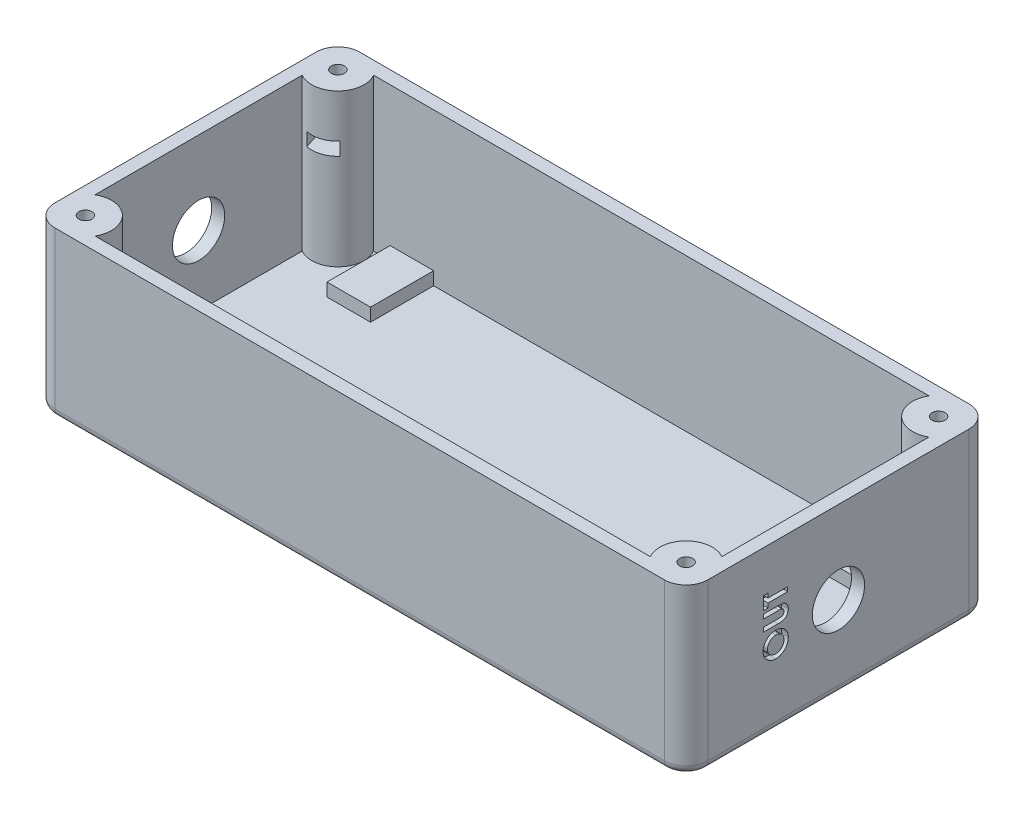
from build123d import *

# Parameters (mm, degrees)
SKETCH_1_W          = 150
SKETCH_1_H          = 70
EXTRUDE_1_DEPTH     = 3
SKETCH_2_W          = 150
SKETCH_2_H          = 70
SKETCH_2_W_2        = 144
SKETCH_2_H_2        = 64
EXTRUDE_2_DEPTH     = 35
SKETCH_3_W          = 10
SKETCH_3_H          = 16.721114434
SKETCH_3_W_2        = 8
SKETCH_3_H_2        = 14.721114434
SKETCH_3_H_3        = 16.439593866
SKETCH_3_H_4        = 20.439593866
EXTRUDE_3_DEPTH     = 3
SKETCH_4_R          = 6.003839286
SKETCH_4_R_2        = 6.002730944
SKETCH_4_R_3        = 5.998096078
SKETCH_4_R_4        = 6.003357904
EXTRUDE_4_DEPTH     = 35
CUT_EXTRUDE_1_DEPTH = 3
SKETCH_6_R          = 1.5
CUT_EXTRUDE_2_DEPTH = 19
FILLET_1_R          = 5
FILLET_2_R          = 2
SKETCH_7_R          = 6
CUT_EXTRUDE_3_DEPTH = 19
CUT_EXTRUDE_START   = -19
SKETCH_8_R          = 6
CUT_EXTRUDE_4_DEPTH = 19
CUT_EXTRUDE_5_DEPTH = 1.5
CUT_EXTRUDE_6_DEPTH = 1.5


with BuildPart() as part:
    # Эскиз1 → Бобышка-Вытянуть1 (new body)
    with BuildSketch(Plane(origin=(0, 0, 0), x_dir=(1, 0, 0), z_dir=(0, 1, 0))):
        Rectangle(SKETCH_1_W, SKETCH_1_H)
    extrude(amount=EXTRUDE_1_DEPTH)

    # Эскиз2 → Бобышка-Вытянуть2 (add)
    with BuildSketch(Plane(origin=(0, 3, 0), x_dir=(1, 0, 0), z_dir=(0, 1, 0))):
        Rectangle(SKETCH_2_W, SKETCH_2_H)
        Rectangle(SKETCH_2_W_2, SKETCH_2_H_2, mode=Mode.SUBTRACT)
    extrude(amount=EXTRUDE_2_DEPTH)

    # Эскиз3 → Бобышка-Вытянуть3 (add)
    with BuildSketch(Plane(origin=(0, 3, 0), x_dir=(1, 0, 0), z_dir=(0, 1, 0))):
        with Locations((-55, 25.860557217)):
            Rectangle(SKETCH_3_W, SKETCH_3_H)
        with Locations((56, 26.860557217)):
            Rectangle(SKETCH_3_W_2, SKETCH_3_H_2)
        with Locations((-55, -25.719796933)):
            Rectangle(SKETCH_3_W, SKETCH_3_H_3)
        with Locations((56, -23.719796933)):
            Rectangle(SKETCH_3_W_2, SKETCH_3_H_4)
    extrude(amount=EXTRUDE_3_DEPTH)

    # Эскиз4 → Бобышка-Вытянуть4 (add)
    with BuildSketch(Plane(origin=(0, 3, 0), x_dir=(1, 0, 0), z_dir=(0, 1, 0))):
        with Locations((-68.996160714, 28.996160714)):
            Circle(SKETCH_4_R)
        with Locations((-68.997269056, -28.997269056)):
            Circle(SKETCH_4_R_2)
        with Locations((69.001903922, 29.001903922)):
            Circle(SKETCH_4_R_3)
        with Locations((68.996642096, -28.996642096)):
            Circle(SKETCH_4_R_4)
    extrude(amount=EXTRUDE_4_DEPTH)

    # Эскиз5 → Вырез-Вытянуть1 (cut)
    with BuildSketch(Plane(origin=(0, 28, 0), x_dir=(1, 0, 0), z_dir=(0, 1, 0))):
        Polygon((-71.315779532, 26.423347363), (-69.499270993, 20.820248272), (-69.121054775, 20.105300037), (-63.546010091, 21.912713418), (-65.608229584, 28.273718567), (-66.676541897, 31.568974066), (-70.064473027, 32.291416213), (-72.384091845, 29.718602861), align=None)
        Polygon((-69.466273228, -25.565063484), (-72.204148358, -27.687335797), (-71.735144186, -31.119541369), (-68.528264884, -32.429474628), (-65.790389754, -30.307202314), (-61.26592419, -26.800048941), (-64.941807664, -22.057910111), align=None)
        Polygon((70.170175126, 25.740747318), (72.410283988, 28.383078161), (71.242012784, 31.644234765), (67.833632717, 32.263060525), (65.593523855, 29.620729682), (61.703168869, 25.031843337), (61.278998761, 24.8214936), (65.998686325, 20.820248272), align=None)
        Polygon((65.808720099, -30.352058393), (68.576506043, -32.43517168), (71.764428041, -31.079755383), (72.184564094, -27.641225799), (69.416778149, -25.558112513), (64.423123183, -21.799747807), (63.845896179, -21.438801652), (60.273148209, -26.18583182), align=None)
    extrude(amount=-CUT_EXTRUDE_1_DEPTH, mode=Mode.SUBTRACT)

    # Эскиз6 → Вырез-Вытянуть2 (cut)
    with BuildSketch(Plane(origin=(0, 38, 0), x_dir=(1, 0, 0), z_dir=(0, 1, 0))):
        with Locations(Location((-68.996160714, 28.996160714, 0), (0, 0, 270))):
            Circle(SKETCH_6_R)
        with Locations(Location((69.001903922, 29.001903922, 0), (0, 0, 270))):
            Circle(SKETCH_6_R)
        with Locations(Location((68.996642096, -28.996642096, 0), (0, 0, 270))):
            Circle(SKETCH_6_R)
        with Locations(Location((-68.997269056, -28.997269056, 0), (0, 0, 270))):
            Circle(SKETCH_6_R)
    extrude(amount=-CUT_EXTRUDE_2_DEPTH, mode=Mode.SUBTRACT)

    # Скругление1
    fillet_1_edges = [part.edges().sort_by_distance(p)[0] for p in [
        (75, 20.5, -35),
        (75, 20.5, 35),
        (-75, 19, 35),
        (-75, 19, -35),
    ]]
    fillet(fillet_1_edges, radius=FILLET_1_R)

    # Скругление2
    fillet_2_edges = [part.edges().sort_by_distance(p)[0] for p in [
        (0, 0, -35),
        (75, 0, 0),
        (0, 0, 35),
        (-75, 0, 0),
        (-73.535533906, 0, 33.535533906),
        (-73.535533906, 0, -33.535533906),
        (73.535533906, 0, 33.535533906),
        (73.535533906, 0, -33.535533906),
    ]]
    fillet(fillet_2_edges, radius=FILLET_2_R)

    # Эскиз7 → Вырез-Вытянуть3 (cut)
    with BuildSketch(Plane.ZY.offset(75)):
        with Locations((0, 19)):
            Circle(SKETCH_7_R)
    extrude(amount=-CUT_EXTRUDE_3_DEPTH, mode=Mode.SUBTRACT)

    # Эскиз8 → Вырез-Вытянуть4 (cut)
    with BuildSketch(Plane(origin=(75, 0, 0), x_dir=(0, 0, -1), z_dir=(1, 0, 0)).offset(CUT_EXTRUDE_START)):
        with Locations(Location((0, 19, 0), (0, 0, 180))):
            Circle(SKETCH_8_R)
    extrude(amount=CUT_EXTRUDE_4_DEPTH, mode=Mode.SUBTRACT)

    # Эскиз9 → Вырез-Вытянуть5 (cut)
    # profile 1 of 4: a face of its own
    with BuildSketch(Plane.ZY.offset(75)):
        Polygon((-15.787488815, 25.603367713), (-15.787488815, 26.657754732), (-11.880637854, 28.071316431), (-15.787488815, 29.488183418), (-15.787488815, 30.539265149), (-10.287488815, 28.545074443), (-10.287488815, 27.594253129), align=None)
    # profile 2 of 4: a face of its own
    with BuildSketch(Plane.ZY.offset(75)):
        with BuildLine():
            add(Edge.make_bspline(
                [(-15.928514456, 21.074020758), (-15.927805241, 21.121804417), (-15.926410736, 21.215759858), (-15.911301912, 21.354137251), (-15.88848745, 21.48743788), (-15.856631116, 21.616160204), (-15.81460728, 21.739461341), (-15.763885282, 21.857772634), (-15.703986372, 21.970987348), (-15.634635156, 22.079225399), (-15.554760816, 22.181520013), (-15.466694512, 22.279525146), (-15.367032767, 22.369311211), (-15.258354786, 22.453591284), (-15.140010797, 22.531789764), (-15.012345477, 22.604411662), (-14.874570904, 22.670733053), (-14.7264846, 22.731544955), (-14.565853649, 22.785920365), (-14.390839346, 22.831721483), (-14.201400614, 22.871003373), (-13.997066239, 22.904160128), (-13.777564514, 22.929221257), (-13.543041295, 22.946112968), (-13.293948699, 22.957704858), (-13.123073225, 22.958650907), (-13.035285289, 22.959136943)],
                knots=[0, 0, 0, 0, 0.879187688, 1.728717895, 2.558878706, 3.367146394, 4.166631857, 4.95393622, 5.734098362, 6.521634849, 7.316678452, 8.120609651, 8.943639266, 9.781961388, 10.650008082, 11.55217958, 12.483362701, 13.462505087, 14.497127373, 15.602264045, 16.790140859, 18.057036744, 19.411188506, 20.855078804, 22.384284574, 24, 24, 24, 24], degree=3))
            add(Edge.make_bspline(
                [(-13.035285289, 22.959136943), (-12.946399052, 22.958611583), (-12.773694688, 22.957590817), (-12.522323434, 22.946595773), (-12.286098584, 22.927655651), (-12.065038029, 22.903263513), (-11.859280703, 22.869786697), (-11.668566267, 22.830866357), (-11.492858717, 22.783925247), (-11.332143689, 22.72807235), (-11.183655, 22.667166838), (-11.045602574, 22.60171935), (-10.919010662, 22.528891672), (-10.799869963, 22.455321113), (-10.693388995, 22.372798497), (-10.59537812, 22.287434444), (-10.509588274, 22.194890626), (-10.43153036, 22.099171955), (-10.364075847, 21.996743622), (-10.305080389, 21.888669267), (-10.257228284, 21.773020153), (-10.215609016, 21.651904894), (-10.185730887, 21.523258912), (-10.16202357, 21.389126413), (-10.148921453, 21.247993056), (-10.147296049, 21.151903783), (-10.146463174, 21.102666591)],
                knots=[0, 0, 0, 0, 1.643824397, 3.193921316, 4.652018541, 6.026147715, 7.305813021, 8.506024873, 9.624771103, 10.66654028, 11.650369642, 12.592128821, 13.489360096, 14.35046321, 15.179132238, 15.977837183, 16.751455772, 17.509897991, 18.259653136, 19.016390304, 19.783391144, 20.571659993, 21.382176161, 22.223003704, 23.089447706, 24, 24, 24, 24], degree=3))
            add(Edge.make_bspline(
                [(-10.146463174, 21.102666591), (-10.147312282, 21.053430817), (-10.148975673, 20.956978659), (-10.161924286, 20.815462416), (-10.185833555, 20.680623571), (-10.215814591, 20.550943702), (-10.257222624, 20.427420235), (-10.306170987, 20.308956633), (-10.366367047, 20.197895415), (-10.433688597, 20.091948159), (-10.511272709, 19.992788146), (-10.597900348, 19.898945455), (-10.692357216, 19.809107408), (-10.797925509, 19.726474648), (-10.912676828, 19.649569235), (-11.036595275, 19.577575007), (-11.170085911, 19.511954321), (-11.313112652, 19.450512607), (-11.469107402, 19.39615374), (-11.639536977, 19.349279724), (-11.825677707, 19.309577057), (-12.027343317, 19.278372685), (-12.244560635, 19.253209137), (-12.477155377, 19.234548341), (-12.725213438, 19.22348628), (-12.895717046, 19.222477062), (-12.983502437, 19.221957456)],
                knots=[0, 0, 0, 0, 0.917318694, 1.797013832, 2.644089644, 3.467281984, 4.274391433, 5.068665368, 5.852346333, 6.624865025, 7.405043053, 8.194438745, 9.002823433, 9.831034161, 10.688848002, 11.574933485, 12.499091769, 13.45866927, 14.473616003, 15.574277631, 16.749933499, 18.017757418, 19.374908438, 20.82337846, 22.364486432, 24, 24, 24, 24], degree=3))
            add(Edge.make_bspline(
                [(-12.983502437, 19.221957456), (-13.105473211, 19.222899304), (-13.340817391, 19.224716612), (-13.680821304, 19.247746873), (-13.995096025, 19.281549454), (-14.283115848, 19.331197439), (-14.545947517, 19.392586486), (-14.781859632, 19.471198356), (-14.994116568, 19.560692253), (-15.119858855, 19.63695255), (-15.180417501, 19.673680213)],
                knots=[0, 0, 0, 0, 1.288568992, 2.486310467, 3.599230591, 4.627010532, 5.572937695, 6.447898582, 7.252493626, 8, 8, 8, 8], degree=3))
            add(Edge.make_bspline(
                [(-15.180417501, 19.673680213), (-15.239910296, 19.71638539), (-15.356230434, 19.799882427), (-15.508937031, 19.945879329), (-15.639539191, 20.102733993), (-15.74508127, 20.273668122), (-15.828311761, 20.455978323), (-15.88709652, 20.651229821), (-15.92134726, 20.858701586), (-15.926089715, 21.001175907), (-15.928514456, 21.074020758)],
                knots=[0, 0, 0, 0, 1.058512271, 2.069600068, 3.047294572, 4.004278952, 4.967380941, 5.939006123, 6.946246673, 8, 8, 8, 8], degree=3))
        make_face()
        with BuildLine():
            add(Edge.make_bspline(
                [(-14.941334969, 21.09825954), (-14.939281259, 21.055067212), (-14.935254897, 20.970387322), (-14.901270964, 20.847436689), (-14.848383698, 20.731999541), (-14.786337854, 20.643215562), (-14.725603947, 20.577514602), (-14.670699099, 20.531394797), (-14.609383257, 20.486938244), (-14.538922468, 20.447718842), (-14.461643082, 20.410308506), (-14.377322482, 20.374878403), (-14.284587327, 20.344413193), (-14.184061923, 20.315357076), (-14.073312367, 20.290227233), (-13.951268717, 20.268238767), (-13.817514294, 20.249506737), (-13.67148846, 20.23599686), (-13.513956399, 20.223592362), (-13.344238793, 20.214660708), (-13.162371299, 20.21093485), (-13.037122289, 20.209748952), (-12.972484809, 20.209136943)],
                knots=[0, 0, 0, 0, 1.076486532, 2.110485037, 3.16053299, 4.233735637, 4.798028448, 5.389657808, 6.0205397, 6.6857231, 7.399126456, 8.163539924, 8.966557062, 9.834164971, 10.774831688, 11.799768806, 12.928987201, 14.14492726, 15.459726247, 16.873396567, 18.386448164, 20, 20, 20, 20], degree=3))
            add(Edge.make_bspline(
                [(-12.972484809, 20.209136943), (-12.888744241, 20.210146739), (-12.728165495, 20.212083096), (-12.497240307, 20.222157328), (-12.286743427, 20.242589178), (-12.095860349, 20.267406071), (-11.925703925, 20.303245243), (-11.774762633, 20.343803208), (-11.644390574, 20.394136126), (-11.533023098, 20.452277299), (-11.438283998, 20.516677424), (-11.357755106, 20.586585172), (-11.288020942, 20.659622076), (-11.231376726, 20.738067452), (-11.187967214, 20.821734254), (-11.156743287, 20.909923992), (-11.137629821, 21.002692716), (-11.134979397, 21.066219781), (-11.133642661, 21.09825954)],
                knots=[0, 0, 0, 0, 1.771738815, 3.39744054, 4.888007323, 6.245018868, 7.467093912, 8.564230264, 9.548241846, 10.417081984, 11.216594933, 11.965786359, 12.669352538, 13.348558586, 14.005353126, 14.656563323, 15.322440191, 16, 16, 16, 16], degree=3))
            add(Edge.make_bspline(
                [(-11.133642661, 21.09825954), (-11.134557355, 21.129199795), (-11.136348213, 21.189776968), (-11.154731123, 21.278112052), (-11.184617743, 21.361647985), (-11.226894465, 21.440132544), (-11.280655785, 21.51384646), (-11.346137954, 21.582429462), (-11.423993675, 21.645364313), (-11.481774136, 21.682030443), (-11.511547309, 21.700923802)],
                knots=[0, 0, 0, 0, 0.992283464, 1.942767638, 2.88273346, 3.832339453, 4.79467288, 5.803907806, 6.868395428, 8, 8, 8, 8], degree=3))
            add(Edge.make_bspline(
                [(-11.511547309, 21.700923802), (-11.552231398, 21.723167552), (-11.637542634, 21.76981089), (-11.781502164, 21.823786641), (-11.94386472, 21.86922042), (-12.125135591, 21.90832461), (-12.326029731, 21.93506949), (-12.545273253, 21.958102148), (-12.783970178, 21.969211371), (-12.949340268, 21.971018347), (-13.035285289, 21.971957456)],
                knots=[0, 0, 0, 0, 0.710965849, 1.490837728, 2.352621235, 3.297892224, 4.334225155, 5.461620853, 6.680770821, 8, 8, 8, 8], degree=3))
            add(Edge.make_bspline(
                [(-13.035285289, 21.971957456), (-13.121976355, 21.971594699), (-13.288841856, 21.970896452), (-13.528396914, 21.958085653), (-13.747190701, 21.940245636), (-13.94473474, 21.914150841), (-14.121508582, 21.880575144), (-14.277500671, 21.839192971), (-14.413018438, 21.790406468), (-14.527926751, 21.732551489), (-14.625583055, 21.668473505), (-14.709364589, 21.600452769), (-14.780895149, 21.528201661), (-14.840443916, 21.45184101), (-14.885943641, 21.36960342), (-14.918070211, 21.283059738), (-14.937505708, 21.192032541), (-14.94004132, 21.129939106), (-14.941334969, 21.09825954)],
                knots=[0, 0, 0, 0, 1.793836731, 3.452829483, 4.963243077, 6.335886805, 7.574563692, 8.684454726, 9.672768357, 10.54971625, 11.340229787, 12.085688095, 12.778991901, 13.440269426, 14.083255152, 14.715733572, 15.344777694, 16, 16, 16, 16], degree=3))
        make_face(mode=Mode.SUBTRACT)
    # profile 3 of 4: a face of its own
    with BuildSketch(Plane.ZY.offset(75)):
        with BuildLine():
            Line((-13.954155482, 15.978367713), (-13.954155482, 14.991188226))
            add(Edge.make_bspline(
                [(-13.954155482, 14.991188226), (-14.028831169, 14.995450028), (-14.174742978, 15.003777335), (-14.386671447, 15.03693759), (-14.586969544, 15.081257019), (-14.775035095, 15.140912066), (-14.950947109, 15.21439064), (-15.11412289, 15.303521536), (-15.265731668, 15.405643625), (-15.403114527, 15.522815368), (-15.526625895, 15.650281332), (-15.634602775, 15.787714738), (-15.724993545, 15.934725187), (-15.799141506, 16.090329655), (-15.858469425, 16.253916944), (-15.898114057, 16.427139873), (-15.9249676, 16.608469976), (-15.927317012, 16.732606216), (-15.928514456, 16.795875726)],
                knots=[0, 0, 0, 0, 1.198928049, 2.342633425, 3.435730849, 4.486331048, 5.502589352, 6.488331875, 7.46361919, 8.428949135, 9.378681775, 10.305958057, 11.226249248, 12.140413166, 13.066341608, 14.010670971, 14.986082777, 16, 16, 16, 16], degree=3))
            add(Edge.make_bspline(
                [(-15.928514456, 16.795875726), (-15.926254085, 16.873573027), (-15.921839371, 17.025323015), (-15.879203681, 17.245094854), (-15.813914106, 17.45144805), (-15.719057362, 17.642187592), (-15.59944224, 17.816981855), (-15.456543141, 17.974859041), (-15.288624085, 18.112740042), (-15.100520713, 18.229549545), (-14.900947905, 18.32614485), (-14.694958239, 18.394484462), (-14.487868215, 18.439166673), (-14.348440781, 18.443943421), (-14.279175514, 18.446316431)],
                knots=[0, 0, 0, 0, 1.075374184, 2.100304875, 3.089917907, 4.066149699, 5.039978333, 6.01615708, 7.006437042, 8.039858286, 9.077679641, 10.07047942, 11.041445745, 12, 12, 12, 12], degree=3))
            add(Edge.make_bspline(
                [(-14.279175514, 18.446316431), (-14.237278176, 18.445393691), (-14.152949186, 18.443536443), (-14.025338724, 18.430622758), (-13.895352554, 18.411249671), (-13.763102107, 18.382039801), (-13.628550381, 18.345612614), (-13.491294438, 18.3014215), (-13.352113534, 18.248439837), (-13.209437014, 18.187557903), (-13.062818487, 18.114905101), (-12.909990691, 18.030395323), (-12.751116323, 17.931203214), (-12.584637046, 17.820557778), (-12.41309481, 17.694106195), (-12.234584774, 17.555198047), (-12.049388217, 17.403134107), (-11.925538631, 17.295292433), (-11.861907886, 17.239886142)],
                knots=[0, 0, 0, 0, 0.728277616, 1.465842947, 2.227925269, 3.011838508, 3.818735656, 4.650581052, 5.517389122, 6.406849312, 7.346234817, 8.360743166, 9.441530624, 10.601362564, 11.834937575, 13.145232671, 14.533293658, 16, 16, 16, 16], degree=3))
            Line((-11.861907886, 17.239886142), (-11.204155482, 16.665867713))
            Line((-11.204155482, 16.665867713), (-11.204155482, 18.516829251))
            Line((-11.204155482, 18.516829251), (-10.287488815, 18.516829251))
            Line((-10.287488815, 18.516829251), (-10.287488815, 14.850162585))
            Line((-10.287488815, 14.850162585), (-10.787689136, 14.850162585))
            Line((-10.787689136, 14.850162585), (-12.520762052, 16.478568033))
            add(Edge.make_bspline(
                [(-12.520762052, 16.478568033), (-12.571315824, 16.525715302), (-12.669223489, 16.61702558), (-12.813019526, 16.746938571), (-12.949449077, 16.864541617), (-13.080094275, 16.96720513), (-13.200531643, 17.061140547), (-13.315314174, 17.139724432), (-13.421209389, 17.208161369), (-13.550291444, 17.279650978), (-13.703081995, 17.349105025), (-13.878994185, 17.412793279), (-14.047243624, 17.451226521), (-14.157074855, 17.456572368), (-14.209764456, 17.459136943)],
                knots=[0, 0, 0, 0, 1.246192343, 2.413505005, 3.49357156, 4.492416076, 5.408771964, 6.246246772, 6.999304986, 7.680960093, 8.904522682, 10.020616941, 11.0504258, 12, 12, 12, 12], degree=3))
            add(Edge.make_bspline(
                [(-14.209764456, 17.459136943), (-14.260739401, 17.457224532), (-14.35951153, 17.453518929), (-14.500014358, 17.412797348), (-14.627225325, 17.349710062), (-14.737343225, 17.260811167), (-14.827834406, 17.153126762), (-14.895139204, 17.028687317), (-14.933973764, 16.88850738), (-14.938834463, 16.790238573), (-14.941334969, 16.739685822)],
                knots=[0, 0, 0, 0, 1.062038974, 2.057870785, 3.028805853, 4.01125022, 4.991535629, 5.949134679, 6.94496649, 8, 8, 8, 8], degree=3))
            add(Edge.make_bspline(
                [(-14.941334969, 16.739685822), (-14.940411252, 16.713569626), (-14.938592767, 16.662155702), (-14.926487605, 16.586581252), (-14.90515352, 16.514666733), (-14.876568849, 16.445611697), (-14.838679663, 16.380153116), (-14.791975204, 16.318456099), (-14.737642339, 16.25987059), (-14.67585096, 16.204665285), (-14.606891763, 16.15442125), (-14.531394549, 16.109794682), (-14.449406182, 16.072895939), (-14.362009033, 16.040408945), (-14.268264385, 16.015353421), (-14.16873329, 15.997109891), (-14.063577672, 15.983240554), (-13.991293073, 15.980021542), (-13.954155482, 15.978367713)],
                knots=[0, 0, 0, 0, 0.903469896, 1.778625579, 2.63899355, 3.493148037, 4.358286772, 5.247621495, 6.164656832, 7.118446693, 8.109501108, 9.111810964, 10.146451449, 11.215617525, 12.33435995, 13.498009769, 14.714554818, 16, 16, 16, 16], degree=3))
        make_face()
    # profile 4 of 4: a face of its own
    with BuildSketch(Plane.ZY.offset(75)):
        with BuildLine():
            Line((-13.954155482, 11.677085661), (-13.954155482, 10.689906174))
            add(Edge.make_bspline(
                [(-13.954155482, 10.689906174), (-14.028831169, 10.694167977), (-14.174742978, 10.702495284), (-14.386671447, 10.735655538), (-14.586969544, 10.779974968), (-14.775035095, 10.839630015), (-14.950947109, 10.913108589), (-15.11412289, 11.002239485), (-15.265731668, 11.104361574), (-15.403114527, 11.221533317), (-15.526625895, 11.348999281), (-15.634602775, 11.486432687), (-15.724993545, 11.633443136), (-15.799141506, 11.789047603), (-15.858469425, 11.952634893), (-15.898114057, 12.125857821), (-15.9249676, 12.307187924), (-15.927317012, 12.431324165), (-15.928514456, 12.494593674)],
                knots=[0, 0, 0, 0, 1.198928049, 2.342633425, 3.435730849, 4.486331048, 5.502589352, 6.488331875, 7.46361919, 8.428949135, 9.378681775, 10.305958057, 11.226249248, 12.140413166, 13.066341608, 14.010670971, 14.986082777, 16, 16, 16, 16], degree=3))
            add(Edge.make_bspline(
                [(-15.928514456, 12.494593674), (-15.926254085, 12.572290975), (-15.921839371, 12.724040964), (-15.879203681, 12.943812803), (-15.813914106, 13.150165999), (-15.719057362, 13.340905541), (-15.59944224, 13.515699804), (-15.456543141, 13.673576989), (-15.288624085, 13.811457991), (-15.100520713, 13.928267494), (-14.900947905, 14.024862799), (-14.694958239, 14.093202411), (-14.487868215, 14.137884622), (-14.348440781, 14.142661369), (-14.279175514, 14.145034379)],
                knots=[0, 0, 0, 0, 1.075374184, 2.100304875, 3.089917907, 4.066149699, 5.039978333, 6.01615708, 7.006437042, 8.039858286, 9.077679641, 10.07047942, 11.041445745, 12, 12, 12, 12], degree=3))
            add(Edge.make_bspline(
                [(-14.279175514, 14.145034379), (-14.237278176, 14.14411164), (-14.152949186, 14.142254392), (-14.025338724, 14.129340706), (-13.895352554, 14.10996762), (-13.763102107, 14.08075775), (-13.628550381, 14.044330562), (-13.491294438, 14.000139449), (-13.352113534, 13.947157786), (-13.209437014, 13.886275852), (-13.062818487, 13.81362305), (-12.909990691, 13.729113272), (-12.751116323, 13.629921163), (-12.584637046, 13.519275727), (-12.41309481, 13.392824143), (-12.234584774, 13.253915996), (-12.049388217, 13.101852056), (-11.925538631, 12.994010381), (-11.861907886, 12.938604091)],
                knots=[0, 0, 0, 0, 0.728277616, 1.465842947, 2.227925269, 3.011838508, 3.818735656, 4.650581052, 5.517389122, 6.406849312, 7.346234817, 8.360743166, 9.441530624, 10.601362564, 11.834937575, 13.145232671, 14.533293658, 16, 16, 16, 16], degree=3))
            Line((-11.861907886, 12.938604091), (-11.204155482, 12.364585661))
            Line((-11.204155482, 12.364585661), (-11.204155482, 14.2155472))
            Line((-11.204155482, 14.2155472), (-10.287488815, 14.2155472))
            Line((-10.287488815, 14.2155472), (-10.287488815, 10.548880533))
            Line((-10.287488815, 10.548880533), (-10.787689136, 10.548880533))
            Line((-10.787689136, 10.548880533), (-12.520762052, 12.177285982))
            add(Edge.make_bspline(
                [(-12.520762052, 12.177285982), (-12.571315824, 12.224433251), (-12.669223489, 12.315743529), (-12.813019526, 12.44565652), (-12.949449077, 12.563259566), (-13.080094275, 12.665923079), (-13.200531643, 12.759858496), (-13.315314174, 12.838442381), (-13.421209389, 12.906879317), (-13.550291444, 12.978368927), (-13.703081995, 13.047822974), (-13.878994185, 13.111511228), (-14.047243624, 13.149944469), (-14.157074855, 13.155290316), (-14.209764456, 13.157854892)],
                knots=[0, 0, 0, 0, 1.246192343, 2.413505005, 3.49357156, 4.492416076, 5.408771964, 6.246246772, 6.999304986, 7.680960093, 8.904522682, 10.020616941, 11.0504258, 12, 12, 12, 12], degree=3))
            add(Edge.make_bspline(
                [(-14.209764456, 13.157854892), (-14.260739401, 13.155942481), (-14.35951153, 13.152236877), (-14.500014358, 13.111515296), (-14.627225325, 13.048428011), (-14.737343225, 12.959529116), (-14.827834406, 12.851844711), (-14.895139204, 12.727405266), (-14.933973764, 12.587225329), (-14.938834463, 12.488956522), (-14.941334969, 12.43840377)],
                knots=[0, 0, 0, 0, 1.062038974, 2.057870785, 3.028805853, 4.01125022, 4.991535629, 5.949134679, 6.94496649, 8, 8, 8, 8], degree=3))
            add(Edge.make_bspline(
                [(-14.941334969, 12.43840377), (-14.940411252, 12.412287575), (-14.938592767, 12.360873651), (-14.926487605, 12.285299201), (-14.90515352, 12.213384682), (-14.876568849, 12.144329645), (-14.838679663, 12.078871065), (-14.791975204, 12.017174048), (-14.737642339, 11.958588539), (-14.67585096, 11.903383233), (-14.606891763, 11.853139199), (-14.531394549, 11.808512631), (-14.449406182, 11.771613888), (-14.362009033, 11.739126894), (-14.268264385, 11.71407137), (-14.16873329, 11.69582784), (-14.063577672, 11.681958502), (-13.991293073, 11.67873949), (-13.954155482, 11.677085661)],
                knots=[0, 0, 0, 0, 0.903469896, 1.778625579, 2.63899355, 3.493148037, 4.358286772, 5.247621495, 6.164656832, 7.118446693, 8.109501108, 9.111810964, 10.146451449, 11.215617525, 12.33435995, 13.498009769, 14.714554818, 16, 16, 16, 16], degree=3))
        make_face()
    extrude(amount=-CUT_EXTRUDE_5_DEPTH, mode=Mode.SUBTRACT)

    # Эскиз10 → Вырез-Вытянуть6 (cut)
    # profile 1 of 3: a face of its own
    with BuildSketch(Plane(origin=(75, 0, 0), x_dir=(0, 0, -1), z_dir=(1, 0, 0))):
        Polygon((-17.164554247, 25.485900968), (-17.164554247, 28.44743943), (-16.17737476, 28.44743943), (-16.17737476, 27.460259942), (-11.664554247, 27.460259942), (-11.664554247, 26.473080455), (-16.17737476, 26.473080455), (-16.17737476, 25.485900968), align=None)
    # profile 2 of 3: a face of its own
    with BuildSketch(Plane(origin=(75, 0, 0), x_dir=(0, 0, -1), z_dir=(1, 0, 0))):
        with BuildLine():
            Line((-17.164554247, 21.184618917), (-17.164554247, 22.171798404))
            Line((-17.164554247, 22.171798404), (-13.586028606, 22.171798404))
            add(Edge.make_bspline(
                [(-13.586028606, 22.171798404), (-13.54892826, 22.171854265), (-13.477269326, 22.171962159), (-13.374458102, 22.177123318), (-13.279602613, 22.181987644), (-13.193471739, 22.190264141), (-13.115798113, 22.203246411), (-13.046295564, 22.215367187), (-12.985583484, 22.231984994), (-12.916429953, 22.256870237), (-12.838743374, 22.295721725), (-12.756858531, 22.357343616), (-12.683974108, 22.430930592), (-12.622776947, 22.517590502), (-12.571015683, 22.614343282), (-12.536779942, 22.723095654), (-12.513558454, 22.840312238), (-12.511675983, 22.921977119), (-12.510708093, 22.963965872)],
                knots=[0, 0, 0, 0, 1.155195489, 2.231248153, 3.20507519, 4.113220553, 4.92363642, 5.657123012, 6.309133385, 6.880755525, 7.944644177, 8.999147208, 10.058600405, 11.156792429, 12.29246015, 13.460660758, 14.694375292, 16, 16, 16, 16], degree=3))
            add(Edge.make_bspline(
                [(-12.510708093, 22.963965872), (-12.512008371, 23.00852536), (-12.514543693, 23.095408816), (-12.539430624, 23.220376838), (-12.579059142, 23.336160416), (-12.635619135, 23.440308031), (-12.703416204, 23.532715987), (-12.780726091, 23.610937524), (-12.867703067, 23.672669192), (-12.947945758, 23.712905103), (-13.021802649, 23.735492008), (-13.087789315, 23.752435526), (-13.165294689, 23.764738643), (-13.253780454, 23.776256896), (-13.353891323, 23.782787046), (-13.465103982, 23.790223886), (-13.587486096, 23.792890799), (-13.672701289, 23.793352508), (-13.717138382, 23.793593276)],
                knots=[0, 0, 0, 0, 1.26131785, 2.459356261, 3.594833267, 4.716926138, 5.803419038, 6.833631221, 7.818372604, 8.814377287, 9.360705024, 10.004324776, 10.743421339, 11.582437492, 12.532246195, 13.585177397, 14.740744533, 16, 16, 16, 16], degree=3))
            Line((-13.717138382, 23.793593276), (-17.164554247, 23.793593276))
            Line((-17.164554247, 23.793593276), (-17.164554247, 24.780772763))
            Line((-17.164554247, 24.780772763), (-13.883504568, 24.780772763))
            add(Edge.make_bspline(
                [(-13.883504568, 24.780772763), (-13.817030658, 24.780635675), (-13.689207812, 24.780372069), (-13.505517388, 24.776323868), (-13.337745652, 24.76770598), (-13.185843578, 24.760467948), (-13.050015809, 24.746459877), (-12.929682312, 24.731866757), (-12.825269547, 24.713266557), (-12.706408226, 24.685590631), (-12.56954426, 24.637829829), (-12.411949034, 24.560834802), (-12.257662748, 24.463088328), (-12.108338028, 24.347581264), (-11.96975369, 24.217071468), (-11.847748559, 24.075019941), (-11.746231988, 23.922078314), (-11.664151188, 23.758953034), (-11.600949469, 23.583922729), (-11.556276883, 23.396574587), (-11.527850479, 23.19583723), (-11.524998107, 23.057348533), (-11.523528606, 22.986001128)],
                knots=[0, 0, 0, 0, 1.170930413, 2.251584989, 3.235934929, 4.130173708, 4.929654547, 5.640582214, 6.264911921, 6.796838084, 7.789064304, 8.810388137, 9.880124863, 11.000704429, 12.131026409, 13.227749078, 14.29171941, 15.356377855, 16.43689688, 17.561893293, 18.743922147, 20, 20, 20, 20], degree=3))
            add(Edge.make_bspline(
                [(-11.523528606, 22.986001128), (-11.524329471, 22.938591015), (-11.525909562, 22.845051833), (-11.539769076, 22.707474164), (-11.560360749, 22.574523847), (-11.589819323, 22.446130355), (-11.630032331, 22.322736415), (-11.677554302, 22.203543387), (-11.731928459, 22.088119503), (-11.797917709, 21.980071917), (-11.867231826, 21.876746268), (-11.94307218, 21.781608944), (-12.022075589, 21.693197161), (-12.106050387, 21.612537836), (-12.194398377, 21.539555579), (-12.287206038, 21.474307109), (-12.384495003, 21.416914246), (-12.488010786, 21.365925434), (-12.60301765, 21.322288538), (-12.733602456, 21.285482549), (-12.881471928, 21.25348629), (-13.047600198, 21.229264996), (-13.231230859, 21.207916941), (-13.433064691, 21.194084278), (-13.652448615, 21.186944227), (-13.804539796, 21.185413606), (-13.883504568, 21.184618917)],
                knots=[0, 0, 0, 0, 1.001237316, 1.975420686, 2.917953599, 3.841913885, 4.754568974, 5.656377887, 6.55158913, 7.445656762, 8.327865759, 9.178398172, 10.013362476, 10.830881591, 11.635451955, 12.431789376, 13.224756564, 14.019278107, 14.866442763, 15.819105778, 16.882716987, 18.059987251, 19.363897986, 20.787153213, 22.331910422, 24, 24, 24, 24], degree=3))
            Line((-13.883504568, 21.184618917), (-17.164554247, 21.184618917))
        make_face()
    # profile 3 of 3: a face of its own
    with BuildSketch(Plane(origin=(75, 0, 0), x_dir=(0, 0, -1), z_dir=(1, 0, 0))):
        with BuildLine():
            add(Edge.make_bspline(
                [(-17.305579888, 17.352687827), (-17.303103524, 17.448311771), (-17.298214619, 17.637095096), (-17.257476656, 17.914732372), (-17.191062972, 18.182267304), (-17.09887415, 18.439673374), (-16.977922804, 18.685781126), (-16.833755011, 18.922989191), (-16.660104277, 19.148293196), (-16.4631553, 19.360914756), (-16.248842459, 19.557353059), (-16.018104542, 19.727523531), (-15.776731431, 19.873036373), (-15.523808376, 19.992747866), (-15.25847307, 20.084702539), (-14.981831181, 20.148948657), (-14.693807783, 20.190276312), (-14.497697078, 20.195025667), (-14.398027805, 20.19743943)],
                knots=[0, 0, 0, 0, 1.014235534, 2.002330665, 2.970116157, 3.9352621, 4.897279957, 5.875024536, 6.875755618, 7.909865842, 8.947091691, 9.955591861, 10.946663836, 11.933282567, 12.91916997, 13.920121047, 14.942943865, 16, 16, 16, 16], degree=3))
            add(Edge.make_bspline(
                [(-14.398027805, 20.19743943), (-14.299481881, 20.194868042), (-14.105293978, 20.189801039), (-13.819920428, 20.150643825), (-13.546258111, 20.085274719), (-13.283750778, 19.995130032), (-13.033722122, 19.877380582), (-12.795128487, 19.734357333), (-12.56878816, 19.564553641), (-12.355654875, 19.372038016), (-12.160875206, 19.161407237), (-11.990347172, 18.93706793), (-11.845881736, 18.70169367), (-11.726915549, 18.4554688), (-11.637173062, 18.196619018), (-11.570064877, 17.928066207), (-11.531244662, 17.647626126), (-11.526126492, 17.457105031), (-11.523528606, 17.360400167)],
                knots=[0, 0, 0, 0, 1.051628416, 2.072267533, 3.067761847, 4.050852917, 5.029392597, 6.012272624, 7.015026456, 8.044749159, 9.073964344, 10.072810436, 11.047668484, 12.017263184, 12.98554948, 13.966731695, 14.967951888, 16, 16, 16, 16], degree=3))
            add(Edge.make_bspline(
                [(-11.523528606, 17.360400167), (-11.525832005, 17.259250852), (-11.530357869, 17.060506276), (-11.573033703, 16.769570497), (-11.638098695, 16.491226149), (-11.732297148, 16.226235902), (-11.854694923, 15.974805755), (-12.002480896, 15.735808151), (-12.178509755, 15.511040564), (-12.377472172, 15.301252211), (-12.595237154, 15.111205595), (-12.825271894, 14.943446393), (-13.065836777, 14.801939236), (-13.317039795, 14.686676858), (-13.577320984, 14.595808724), (-13.848265212, 14.531711557), (-14.129222742, 14.493847836), (-14.320054709, 14.488573639), (-14.416757773, 14.485900968)],
                knots=[0, 0, 0, 0, 1.067953136, 2.098381936, 3.099641766, 4.083805132, 5.062469929, 6.048665414, 7.046702845, 8.073106546, 9.098695993, 10.09591865, 11.076726721, 12.041940862, 13.011263376, 13.984305721, 14.978557872, 16, 16, 16, 16], degree=3))
            add(Edge.make_bspline(
                [(-14.416757773, 14.485900968), (-14.481814437, 14.486740051), (-14.611104, 14.488407593), (-14.802706188, 14.508485416), (-14.990562077, 14.5374103), (-15.1739532, 14.580119623), (-15.354390422, 14.632339701), (-15.530266248, 14.699112025), (-15.702773393, 14.776096141), (-15.869978402, 14.865104405), (-16.029955329, 14.96572863), (-16.184079473, 15.073184969), (-16.328317301, 15.191565052), (-16.464207191, 15.318449561), (-16.59122862, 15.454262627), (-16.709249548, 15.599278041), (-16.819620709, 15.75245419), (-16.920876876, 15.91380516), (-17.01038141, 16.082137532), (-17.090533191, 16.25373676), (-17.156330675, 16.429315942), (-17.210504041, 16.607846108), (-17.254038914, 16.789074943), (-17.28297218, 16.974442885), (-17.303042015, 17.162374433), (-17.304731923, 17.289099478), (-17.305579888, 17.352687827)],
                knots=[0, 0, 0, 0, 1.034634222, 2.056167603, 3.061938024, 4.056975325, 5.049831446, 6.048294015, 7.047371884, 8.053753139, 9.058980286, 10.052730068, 11.041053953, 12.024946181, 13.008838409, 13.997162294, 14.997691456, 16.01096975, 17.025258359, 18.029177048, 19.022170708, 20.005507574, 20.996177714, 21.984639769, 22.988728483, 24, 24, 24, 24], degree=3))
        make_face()
        with BuildLine():
            add(Edge.make_bspline(
                [(-16.318400401, 17.337263148), (-16.316673609, 17.272908046), (-16.313265613, 17.145896829), (-16.287301292, 16.959594504), (-16.24583332, 16.780737693), (-16.185767469, 16.610317869), (-16.109318886, 16.447596419), (-16.01675469, 16.292284887), (-15.904893093, 16.146534018), (-15.779739443, 16.008400364), (-15.640289515, 15.883619338), (-15.490845201, 15.773371366), (-15.331656071, 15.68111157), (-15.164200954, 15.603843413), (-14.986596861, 15.545677615), (-14.800234985, 15.504247862), (-14.604794216, 15.478065804), (-14.471562497, 15.474765523), (-14.403536619, 15.473080455)],
                knots=[0, 0, 0, 0, 1.033739768, 2.040188636, 3.016340934, 3.979330865, 4.937572243, 5.900995986, 6.878200029, 7.884839167, 8.891893314, 9.879764717, 10.863503415, 11.843163062, 12.837761627, 13.859916423, 14.907309254, 16, 16, 16, 16], degree=3))
            add(Edge.make_bspline(
                [(-14.403536619, 15.473080455), (-14.328150821, 15.475319724), (-14.180407149, 15.479708321), (-13.964845807, 15.510444252), (-13.761077206, 15.5634992), (-13.5701131, 15.63873807), (-13.39087797, 15.734095961), (-13.224381851, 15.850896013), (-13.069841757, 15.989119351), (-12.979591128, 16.095546453), (-12.933785016, 16.149562827)],
                knots=[0, 0, 0, 0, 1.078420897, 2.113526272, 3.107597235, 4.084297302, 5.043369457, 6.005430726, 6.9876695, 8, 8, 8, 8], degree=3))
            add(Edge.make_bspline(
                [(-12.933785016, 16.149562827), (-12.899946911, 16.193816265), (-12.83303308, 16.281326103), (-12.747269278, 16.421010856), (-12.673761144, 16.564858647), (-12.614367442, 16.713954988), (-12.567649354, 16.867984994), (-12.534933445, 17.026927543), (-12.514401383, 17.190557427), (-12.511947412, 17.301211624), (-12.510708093, 17.357094878)],
                knots=[0, 0, 0, 0, 1.023928204, 2.024787132, 3.009472467, 3.9914905, 4.972207045, 5.96565515, 6.972602802, 8, 8, 8, 8], degree=3))
            add(Edge.make_bspline(
                [(-12.510708093, 17.357094878), (-12.512452089, 17.420342097), (-12.515883456, 17.544782988), (-12.541491544, 17.727635691), (-12.585026244, 17.902728374), (-12.644120898, 18.071705317), (-12.72340697, 18.232224417), (-12.81707563, 18.386839236), (-12.929663542, 18.532854354), (-13.057454288, 18.67021647), (-13.197394256, 18.796209343), (-13.346887659, 18.907358854), (-13.5045435, 19.00113633), (-13.670335698, 19.077815289), (-13.844082047, 19.137880277), (-14.026314794, 19.178890828), (-14.216203672, 19.20527247), (-14.345420854, 19.208576662), (-14.411248959, 19.210259942)],
                knots=[0, 0, 0, 0, 1.026460056, 2.019592442, 2.989754624, 3.951362471, 4.919177453, 5.890456226, 6.881277895, 7.906300149, 8.932084862, 9.933608786, 10.925308803, 11.904168404, 12.893913482, 13.903284022, 14.931853825, 16, 16, 16, 16], degree=3))
            add(Edge.make_bspline(
                [(-14.411248959, 19.210259942), (-14.476700928, 19.208524404), (-14.605533149, 19.20510826), (-14.794899614, 19.179355373), (-14.976115053, 19.136542074), (-15.149646592, 19.076033199), (-15.31640526, 19.000651731), (-15.474943734, 18.905960059), (-15.62512485, 18.79401067), (-15.766055762, 18.666850095), (-15.895570925, 18.528466392), (-16.007964331, 18.379891657), (-16.105631202, 18.225290287), (-16.182139347, 18.061113112), (-16.24309326, 17.890719542), (-16.287980587, 17.713069698), (-16.313083212, 17.527490754), (-16.316612206, 17.40123756), (-16.318400401, 17.337263148)],
                knots=[0, 0, 0, 0, 1.055040155, 2.076685641, 3.074845078, 4.052329834, 5.035358467, 6.020382375, 7.023447318, 8.050688466, 9.077178457, 10.074336316, 11.0503314, 12.019748348, 12.988025369, 13.964577102, 14.968620271, 16, 16, 16, 16], degree=3))
        make_face(mode=Mode.SUBTRACT)
    extrude(amount=-CUT_EXTRUDE_6_DEPTH, mode=Mode.SUBTRACT)


solid = part.part
